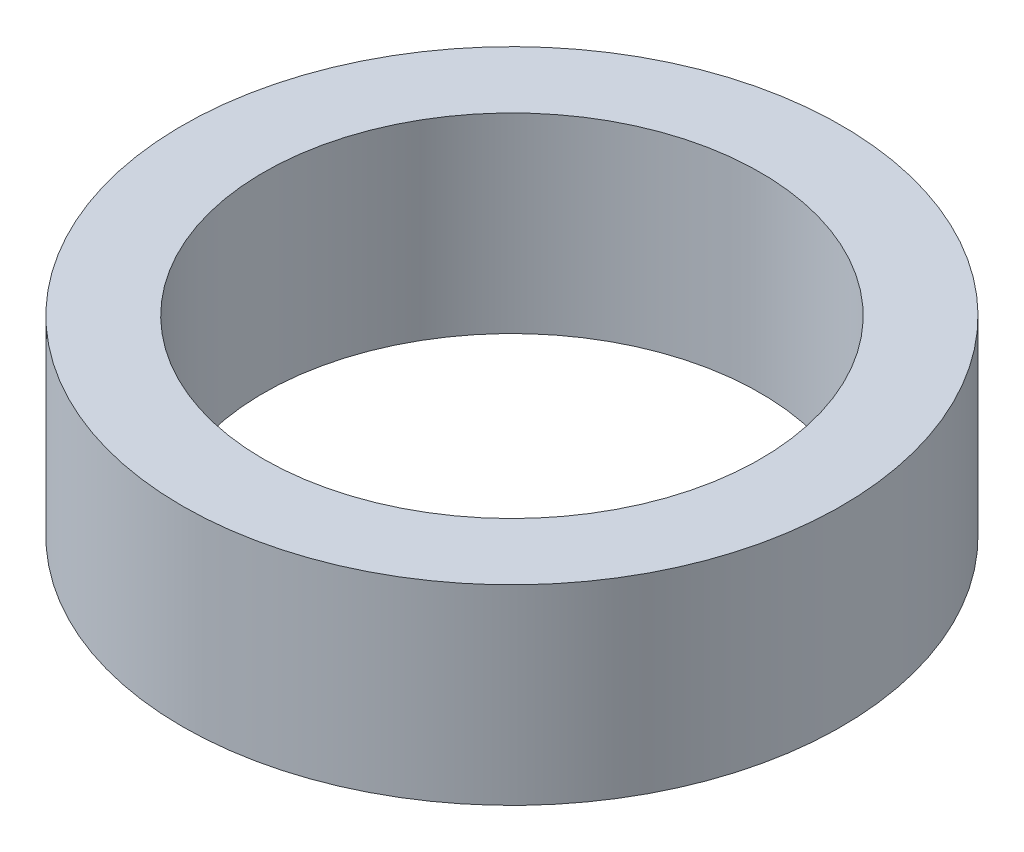
from build123d import *

# Parameters (mm, degrees)
SKETCH1_R           = 3.45
SKETCH1_R_2         = 2.6
BOSS_EXTRUDE1_DEPTH = 2


with BuildPart() as part:
    # Sketch1 → Boss-Extrude1 (new body)
    with BuildSketch(Plane(origin=(0, 0, 0), x_dir=(1, 0, 0), z_dir=(0, 1, 0))):
        with Locations(Location((0, 0, 0), (0, 0, 270))):
            Circle(SKETCH1_R)
        with Locations(Location((0, 0, 0), (0, 0, 270))):
            Circle(SKETCH1_R_2, mode=Mode.SUBTRACT)
    extrude(amount=BOSS_EXTRUDE1_DEPTH)


solid = part.part
